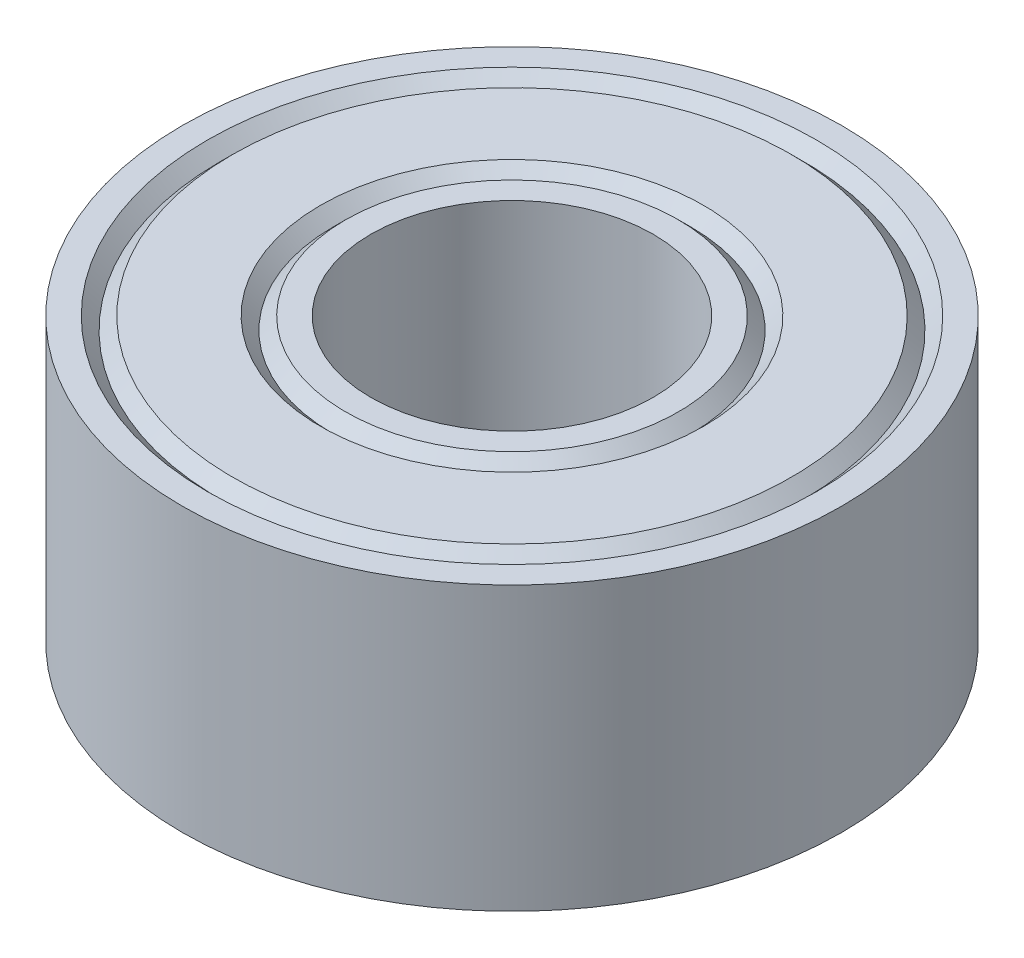
from build123d import *


with BuildPart() as part:
    # Sketch1 → Revolve1 (revolve)
    with BuildSketch(Plane.XY):
        Polygon((-1.5, 1.5), (-1.766666667, 1.5), (-1.9, 1.366666667), (-2.033333333, 1.5), (-2.966666667, 1.5), (-3.1, 1.366666667), (-3.233333333, 1.5), (-3.5, 1.5), (-3.5, -1.5), (-3.233333333, -1.5), (-3.1, -1.366666667), (-2.966666667, -1.5), (-2.033333333, -1.5), (-1.9, -1.366666667), (-1.766666667, -1.5), (-1.5, -1.5), align=None)
    revolve(axis=Axis((0, 1.5, 0), (0, -1, 0)))


solid = part.part
